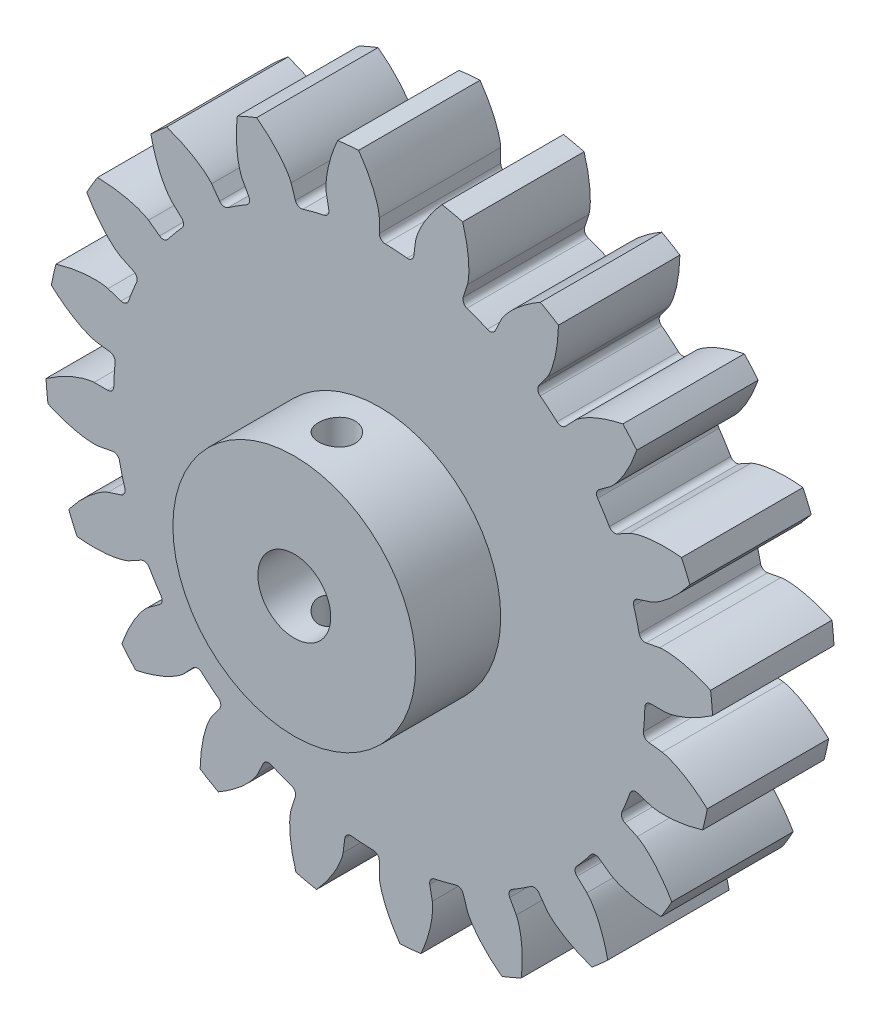
from build123d import *

# Parameters (mm, degrees)
SKETCH1_R           = 27.5
BOSS_EXTRUDE1_DEPTH = 10
CUT_EXTRUDE1_DEPTH  = 41.155946011
CIRPATTERN6_COUNT   = 20
SKETCH3_R           = 3
CUT_EXTRUDE2_DEPTH  = 10
BOSS_EXTRUDE2_START = 7
SKETCH4_R           = 10
SKETCH4_R_2         = 3
BOSS_EXTRUDE2_DEPTH = 7
SKETCH5_R           = 1.5
CUT_EXTRUDE3_DEPTH  = 43.375937035


with BuildPart() as part:
    # Sketch1 → Boss-Extrude1 (new body)
    with BuildSketch(Plane.XY):
        Circle(SKETCH1_R)
    extrude(amount=BOSS_EXTRUDE1_DEPTH)

    # Sketch2 → Cut-Extrude1 (cut, symmetric)
    with BuildSketch(Plane.XY.offset(10)):
        with BuildLine():
            Line((23.49231552, 0), (22.36941271, 0))
            ThreePointArc((22.36941271, 0), (22.019831956, -0.142518118), (21.869537566, -0.488826816))
            ThreePointArc((21.869537566, -0.488826816), (21.830723885, -1.391085782), (21.754702114, -2.290973794))
            ThreePointArc((21.754702114, -2.290973794), (21.859824804, -2.653558043), (22.18848867, -2.839294904))
            Line((22.18848867, -2.839294904), (23.30230943, -2.981822215))
            add(Edge.make_bspline(
                [(23.30230943, -2.981822215), (23.310260749, -2.982956167), (23.332511196, -2.986490812), (23.374367375, -2.994570792), (23.442320766, -3.009732376), (23.528359699, -3.031949065), (23.63887141, -3.063977973), (23.768096607, -3.10595354), (23.90902325, -3.156508958), (24.061085302, -3.216260883), (24.211608727, -3.280051768), (24.36060245, -3.347554552), (24.507936388, -3.418273403), (24.685054198, -3.508016955), (24.895514928, -3.621285348), (25.1385407, -3.761843666), (25.410531044, -3.930837724), (25.683610942, -4.113191596), (25.948855032, -4.300907339), (26.21264073, -4.499956031), (26.464869406, -4.699191067), (26.702507889, -4.898957777), (26.862429549, -5.037478518), (26.966800243, -5.131176062), (27.009633306, -5.170078206)],
                knots=[0, 0, 0, 0, 0, 0.005376749, 0.015083688, 0.02853182, 0.04661014, 0.064854849, 0.092110525, 0.119476176, 0.146842496, 0.174208854, 0.201574956, 0.228941013, 0.256307345, 0.307035032, 0.361767352, 0.416499661, 0.471231937, 0.525964282, 0.580696616, 0.635428982, 0.690161387, 0.728074997, 0.728074997, 0.728074997, 0.728074997, 0.728074997], degree=4))
            ThreePointArc((27.009633306, -5.170078206), (27.377133852, -2.596640529), (27.5, 0))
            ThreePointArc((27.5, 0), (27.486847982, 0.850404607), (27.447404509, 1.699995793))
            add(Edge.make_bspline(
                [(23.49231552, 0), (23.500346458, 0.00011554), (23.522865588, 0.000797402), (23.565408805, 0.003499328), (23.634737011, 0.009913127), (23.72289997, 0.021029415), (23.836583213, 0.038772292), (23.970091091, 0.064006121), (24.116294794, 0.096265172), (24.274711132, 0.136232959), (24.432113944, 0.180402332), (24.588470567, 0.228447743), (24.743589038, 0.279893883), (24.930665246, 0.346430457), (25.153800649, 0.432069467), (25.41270155, 0.540644281), (25.703942036, 0.673748444), (25.997958993, 0.819966071), (26.284884086, 0.972496783), (26.571801047, 1.136453893), (26.847278111, 1.302062744), (27.108350472, 1.470050867), (27.284560783, 1.587152785), (27.399980127, 1.666844985), (27.447404509, 1.699995793)],
                knots=[0, 0, 0, 0, 0, 0.005376749, 0.015083688, 0.02853182, 0.04661014, 0.064854849, 0.092110525, 0.119476176, 0.146842496, 0.174208854, 0.201574956, 0.228941013, 0.256307345, 0.307035032, 0.361767352, 0.416499661, 0.471231937, 0.525964282, 0.580696616, 0.635428982, 0.690161387, 0.728074997, 0.728074997, 0.728074997, 0.728074997, 0.728074997], degree=4))
        make_face()
    cut_extrude1 = extrude(amount=CUT_EXTRUDE1_DEPTH, both=True, mode=Mode.SUBTRACT)

    # CirPattern6: Cut-Extrude1 ×20 about axis
    cirpattern6_axis = Axis((0, 0, 10), (0, 0, -1))
    for i in range(1, CIRPATTERN6_COUNT):
        add(cut_extrude1.rotate(cirpattern6_axis, i * 360 / CIRPATTERN6_COUNT), mode=Mode.SUBTRACT)

    # Sketch3 → Cut-Extrude2 (cut)
    with BuildSketch(Plane.XY.offset(10)):
        Circle(SKETCH3_R)
    extrude(amount=-CUT_EXTRUDE2_DEPTH, mode=Mode.SUBTRACT)

    # Sketch4 → Boss-Extrude2 (add)
    with BuildSketch(Plane.XY.offset(10).offset(BOSS_EXTRUDE2_START)):
        Circle(SKETCH4_R)
        Circle(SKETCH4_R_2, mode=Mode.SUBTRACT)
    boss_extrude2 = extrude(amount=-BOSS_EXTRUDE2_DEPTH)

    # Sketch5 → Cut-Extrude3 (cut, symmetric)
    with BuildSketch(Plane(origin=(0, 0, 0), x_dir=(1, 0, 0), z_dir=(0, 1, 0))):
        with Locations(Location((0, -13.5, 0), (0, 0, 270))):
            Circle(SKETCH5_R)
    cut_extrude3 = extrude(amount=CUT_EXTRUDE3_DEPTH, both=True, mode=Mode.SUBTRACT)

    # Mirror2: Boss-Extrude2, Cut-Extrude3 across plane
    add(boss_extrude2.mirror(Plane.XY.offset(5)))
    add(cut_extrude3.mirror(Plane.XY.offset(5)), mode=Mode.SUBTRACT)


solid = part.part
